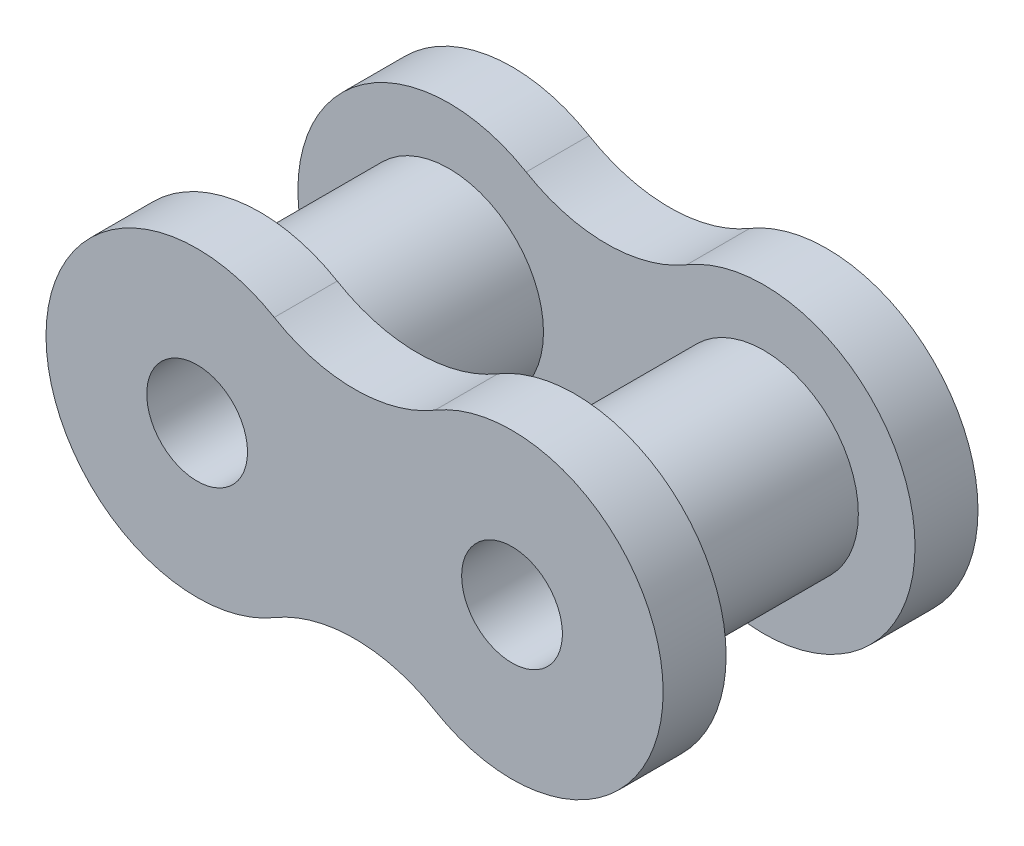
from build123d import *

# Parameters (mm, degrees)
SKETCH1_R           = 0.08
BOSS_EXTRUDE1_DEPTH = 0.1
BOSS_EXTRUDE2_START = 0.3
SKETCH2_R           = 0.15
SKETCH2_R_2         = 0.08
BOSS_EXTRUDE2_DEPTH = 0.3


with BuildPart() as part:
    # Sketch1 → Boss-Extrude1 (new body)
    with BuildSketch(Plane.XY):
        with BuildLine():
            ThreePointArc((-0.12755102, 0.206412808), (-0.49, 0), (-0.12755102, -0.206412808))
            ThreePointArc((-0.12755102, -0.206412808), (0, -0.17142615), (0.12755102, -0.206412808))
            ThreePointArc((0.12755102, -0.206412808), (0.49, 0), (0.12755102, 0.206412808))
            ThreePointArc((0.12755102, 0.206412808), (0, 0.17142615), (-0.12755102, 0.206412808))
        make_face()
        with Locations((-0.25, 0)):
            Circle(SKETCH1_R, mode=Mode.SUBTRACT)
        with Locations(Location((0.25, 0, 0), (0, 0, 180))):
            Circle(SKETCH1_R, mode=Mode.SUBTRACT)
    boss_extrude1 = extrude(amount=-BOSS_EXTRUDE1_DEPTH)

    # Sketch2 → Boss-Extrude2 (add)
    # profile 1 of 2: a face of its own
    with BuildSketch(Plane.XY.offset(BOSS_EXTRUDE2_START)):
        with Locations((-0.25, 0)):
            Circle(SKETCH2_R)
        with Locations((-0.25, 0)):
            Circle(SKETCH2_R_2, mode=Mode.SUBTRACT)
    # profile 2 of 2: a face of its own
    with BuildSketch(Plane.XY.offset(BOSS_EXTRUDE2_START)):
        with Locations(Location((0.25, 0, 0), (0, 0, 180))):
            Circle(SKETCH2_R)
        with Locations(Location((0.25, 0, 0), (0, 0, 180))):
            Circle(SKETCH2_R_2, mode=Mode.SUBTRACT)
    extrude(amount=-BOSS_EXTRUDE2_DEPTH)

    # Mirror1: Boss-Extrude1 across plane
    add(boss_extrude1.mirror(Plane.XY.offset(0.15)))


solid = part.part
